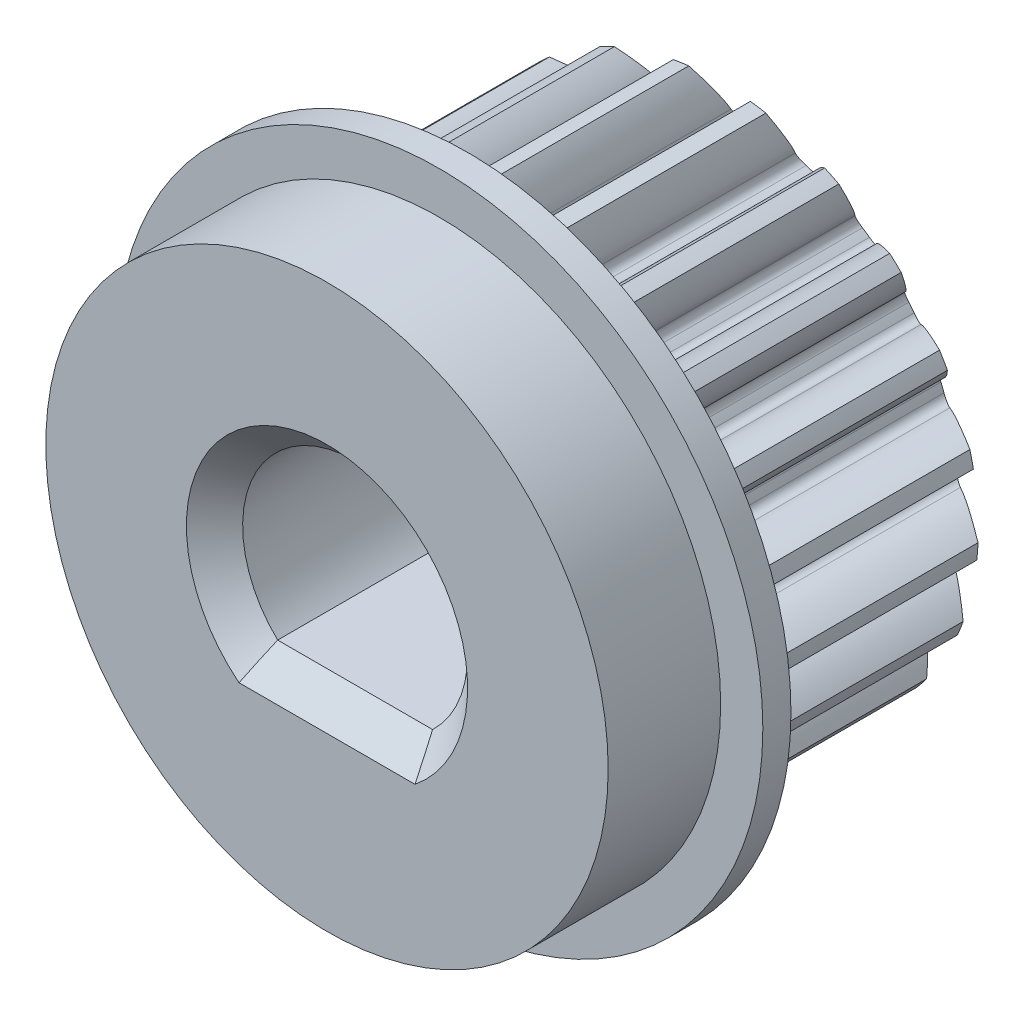
from build123d import *

# Parameters (mm, degrees)
SKETCH1_R           = 9.2
LASHENA_DEPTH       = 10
CUT_EXTRUDEA_DEPTH  = 10
WWW_KYTOOL_CN_COUNT = 21
SKETCH3_R           = 11.5
BOSS_EXTRUDE2_DEPTH = 1
SKETCH4_R           = 10
BOSS_EXTRUDE3_DEPTH = 4
CUT_EXTRUDE2_DEPTH  = 23.124646994
CHAMFER1_SIZE       = 1


with BuildPart() as part:
    # Sketch1 → LaShenA (new body)
    with BuildSketch(Plane.XY):
        Circle(SKETCH1_R)
    extrude(amount=LASHENA_DEPTH)

    # SketchA → Cut-ExtrudeA (cut)
    with BuildSketch(Plane.XY.offset(10)):
        with BuildLine():
            ThreePointArc((0.150151275, 7.398476505), (0, 7.4), (-0.150151275, 7.398476505))
            ThreePointArc((-0.150151275, 7.398476505), (-0.362464006, 7.478984947), (-0.459770099, 7.684143007))
            add(Edge.make_bspline(
                [(-0.459770099, 7.684143007), (-0.463710347, 7.749584187), (-0.466358647, 7.838391604), (-0.480749143, 7.937246168), (-0.49064274, 7.983176084), (-0.499380614, 8.019547534), (-0.510625332, 8.061218439), (-0.524622128, 8.108088993), (-0.541673864, 8.160032671), (-0.562058501, 8.216916082), (-0.586055285, 8.278592756), (-0.613935885, 8.34490535), (-0.645966621, 8.415685217), (-0.682407247, 8.490752804), (-0.723510802, 8.569917825), (-0.769523146, 8.65297951), (-0.820682606, 8.739726855), (-0.877219594, 8.829938884), (-0.939356246, 8.923384924), (-1.007306065, 9.019824899), (-1.0812736, 9.119009621), (-1.161454005, 9.220681117), (-1.279349009, 9.362150803), (-1.374036255, 9.466673471), (-1.440241313, 9.536059069)],
                knots=[0.123319169, 0.123319169, 0.123319169, 0.123319169, 0.203409424, 0.232855636, 0.245818138, 0.261137458, 0.278813596, 0.298846552, 0.321236326, 0.345982919, 0.37308633, 0.402546559, 0.434363606, 0.468537472, 0.505068156, 0.543955658, 0.585199978, 0.628801117, 0.674759074, 0.723073849, 0.773745443, 0.826773855, 0.882159085, 1, 1, 1, 1], degree=3))
            ThreePointArc((-1.440241313, 9.536059069), (0, 9.644206427), (1.440241313, 9.536059069))
            add(Edge.make_bspline(
                [(0.459770099, 7.684143007), (0.463710347, 7.749584187), (0.466358647, 7.838391604), (0.480749143, 7.937246168), (0.49064274, 7.983176084), (0.499380614, 8.019547534), (0.510625332, 8.061218439), (0.524622128, 8.108088993), (0.541673864, 8.160032671), (0.562058501, 8.216916082), (0.586055285, 8.278592756), (0.613935885, 8.34490535), (0.645966621, 8.415685217), (0.682407247, 8.490752804), (0.723510802, 8.569917825), (0.769523146, 8.65297951), (0.820682606, 8.739726855), (0.877219594, 8.829938884), (0.939356246, 8.923384924), (1.007306065, 9.019824899), (1.0812736, 9.119009621), (1.161454005, 9.220681117), (1.279349009, 9.362150803), (1.374036255, 9.466673471), (1.440241313, 9.536059069)],
                knots=[0.123319169, 0.123319169, 0.123319169, 0.123319169, 0.203409424, 0.232855636, 0.245818138, 0.261137458, 0.278813596, 0.298846552, 0.321236326, 0.345982919, 0.37308633, 0.402546559, 0.434363606, 0.468537472, 0.505068156, 0.543955658, 0.585199978, 0.628801117, 0.674759074, 0.723073849, 0.773745443, 0.826773855, 0.882159085, 1, 1, 1, 1], degree=3))
            ThreePointArc((0.459770099, 7.684143007), (0.362464006, 7.478984947), (0.150151275, 7.398476505))
        make_face()
    cut_extrudea = extrude(amount=-CUT_EXTRUDEA_DEPTH, mode=Mode.SUBTRACT)

    # www.KYTool.cn: Cut-ExtrudeA ×21 about axis
    www_kytool_cn_axis = Axis((0, 0, -88.99), (0, 0, 1))
    for i in range(1, WWW_KYTOOL_CN_COUNT):
        add(cut_extrudea.rotate(www_kytool_cn_axis, i * 360 / WWW_KYTOOL_CN_COUNT), mode=Mode.SUBTRACT)

    # Sketch3 → Boss-Extrude2 (add)
    with BuildSketch(Plane.XY.offset(10)):
        Circle(SKETCH3_R)
    extrude(amount=BOSS_EXTRUDE2_DEPTH)

    # Sketch4 → Boss-Extrude3 (add)
    with BuildSketch(Plane.XY.offset(11)):
        Circle(SKETCH4_R)
    extrude(amount=BOSS_EXTRUDE3_DEPTH)

    # Sketch5 → Cut-Extrude2 (cut, through all)
    with BuildSketch(Plane(origin=(0, 0, 0), x_dir=(-1, 0, 0), z_dir=(0, 0, -1))):
        with BuildLine():
            Line((2.754995463, -2.9), (-2.754995463, -2.9))
            ThreePointArc((-2.754995463, -2.9), (0, 4), (2.754995463, -2.9))
        make_face()
    extrude(amount=-CUT_EXTRUDE2_DEPTH, mode=Mode.SUBTRACT)

    # Chamfer1
    chamfer1_edges = [part.edges().sort_by_distance(p)[0] for p in [
        (0, 4, 15),
        (0, -2.9, 15),
    ]]
    chamfer(chamfer1_edges, length=CHAMFER1_SIZE)

    # Sketch15 → Cut-Revolve5 (revolve, cut)
    with BuildSketch(Plane(origin=(0, 0, 0), x_dir=(1, 0, 0), z_dir=(0, 1, 0))):
        Polygon((9.2, 0), (7.4, 0), (9.2, -1.039230485), align=None)
    revolve(axis=Axis((0, 0, 0), (0, 0, 1)), mode=Mode.SUBTRACT)


solid = part.part
